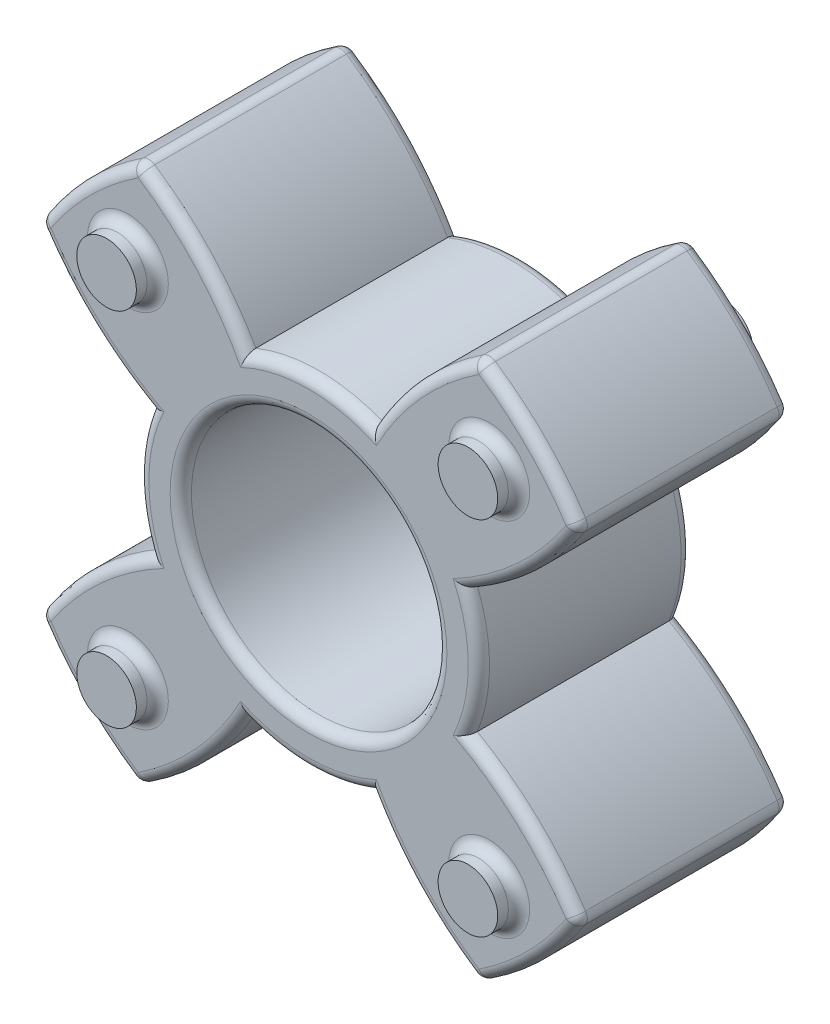
from build123d import *

# Parameters (mm, degrees)
SKETCH1_R           = 6
BOSS_EXTRUDE1_DEPTH = 5
BOSS_EXTRUDE2_START = 1
SKETCH2_R           = 1.4
BOSS_EXTRUDE2_DEPTH = 12
FILLET1_R           = 0.5


with BuildPart() as part:
    # Sketch1 → Boss-Extrude1 (new, symmetric)
    with BuildSketch(Plane.XY):
        with BuildLine():
            ThreePointArc((-7.428763251, 2.96875), (-8, 0), (-7.428763251, -2.96875))
            ThreePointArc((-7.428763251, -2.96875), (-10.368472369, -5.160499055), (-12.68857754, -8))
            ThreePointArc((-12.68857754, -8), (-10.606601718, -10.606601718), (-8, -12.68857754))
            ThreePointArc((-8, -12.68857754), (-5.160499055, -10.368472369), (-2.96875, -7.428763251))
            ThreePointArc((-2.96875, -7.428763251), (0, -8), (2.96875, -7.428763251))
            ThreePointArc((2.96875, -7.428763251), (5.160499055, -10.368472369), (8, -12.68857754))
            ThreePointArc((8, -12.68857754), (10.606601718, -10.606601718), (12.68857754, -8))
            ThreePointArc((12.68857754, -8), (10.368472369, -5.160499055), (7.428763251, -2.96875))
            ThreePointArc((7.428763251, -2.96875), (8, 0), (7.428763251, 2.96875))
            ThreePointArc((7.428763251, 2.96875), (10.368472369, 5.160499055), (12.68857754, 8))
            ThreePointArc((12.68857754, 8), (10.606601718, 10.606601718), (8, 12.68857754))
            ThreePointArc((8, 12.68857754), (5.160499055, 10.368472369), (2.96875, 7.428763251))
            ThreePointArc((2.96875, 7.428763251), (0, 8), (-2.96875, 7.428763251))
            ThreePointArc((-2.96875, 7.428763251), (-5.160499055, 10.368472369), (-8, 12.68857754))
            ThreePointArc((-8, 12.68857754), (-10.606601718, 10.606601718), (-12.68857754, 8))
            ThreePointArc((-12.68857754, 8), (-10.368472369, 5.160499055), (-7.428763251, 2.96875))
        make_face()
        Circle(SKETCH1_R, mode=Mode.SUBTRACT)
    extrude(amount=BOSS_EXTRUDE1_DEPTH, both=True)

    # Sketch2 → Boss-Extrude2 (add)
    with BuildSketch(Plane.XY.offset(5).offset(BOSS_EXTRUDE2_START)):
        with Locations((-8.485281374, 8.485281374)):
            Circle(SKETCH2_R)
        with Locations((8.485281374, 8.485281374)):
            Circle(SKETCH2_R)
        with Locations((8.485281374, -8.485281374)):
            Circle(SKETCH2_R)
        with Locations((-8.485281374, -8.485281374)):
            Circle(SKETCH2_R)
    extrude(amount=-BOSS_EXTRUDE2_DEPTH)

    # Fillet1
    fillet1_edges = [part.edges().sort_by_distance(p)[0] for p in [
        (-5.160499055, -10.368472369, 5),
        (0, -8, 5),
        (-8, 0, -5),
        (-10.368472369, 5.160499055, -5),
        (-10.606601718, 10.606601718, -5),
        (-5.160499055, 10.368472369, -5),
        (0, 8, -5),
        (5.160499055, -10.368472369, 5),
        (5.160499055, 10.368472369, -5),
        (10.606601718, 10.606601718, -5),
        (10.368472369, 5.160499055, -5),
        (8, 0, -5),
        (10.368472369, -5.160499055, -5),
        (10.606601718, -10.606601718, -5),
        (5.160499055, -10.368472369, -5),
        (0, -8, -5),
        (10.606601718, -10.606601718, 5),
        (-5.160499055, -10.368472369, -5),
        (-10.606601718, -10.606601718, -5),
        (-10.368472369, -5.160499055, -5),
        (10.368472369, -5.160499055, 5),
        (8, 0, 5),
        (-12.68857754, 8, 0),
        (-8, 12.68857754, 0),
        (8, 12.68857754, 0),
        (12.68857754, 8, 0),
        (12.68857754, -8, 0),
        (8, -12.68857754, 0),
        (-8, -12.68857754, 0),
        (-12.68857754, -8, 0),
        (10.368472369, 5.160499055, 5),
        (10.606601718, 10.606601718, 5),
        (5.160499055, 10.368472369, 5),
        (0, 8, 5),
        (-6, 0, -5),
        (-6, 0, 5),
        (-10.368472369, -5.160499055, 5),
        (-5.160499055, 10.368472369, 5),
        (-10.606601718, 10.606601718, 5),
        (-10.368472369, 5.160499055, 5),
        (-9.885281374, 8.485281374, 5),
        (-8, 0, 5),
        (-9.885281374, 8.485281374, -5),
        (7.085281374, 8.485281374, 5),
        (7.085281374, 8.485281374, -5),
        (7.085281374, -8.485281374, 5),
        (7.085281374, -8.485281374, -5),
        (-9.885281374, -8.485281374, 5),
        (-9.885281374, -8.485281374, -5),
        (-10.606601718, -10.606601718, 5),
    ]]
    fillet(fillet1_edges, radius=FILLET1_R)


solid = part.part
